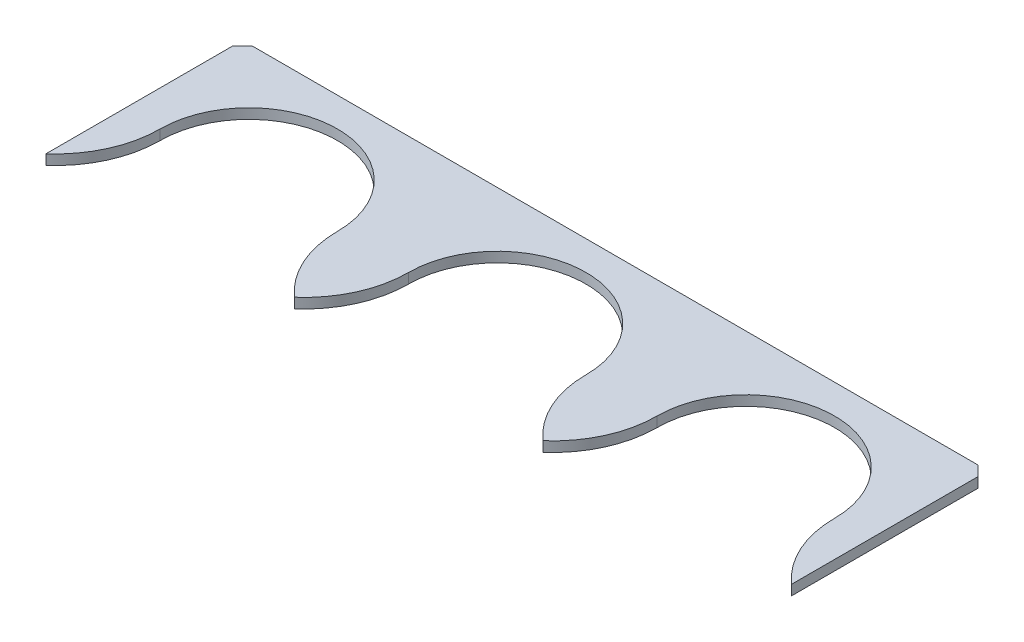
from build123d import *

# Parameters (mm, degrees)
BOSS_EXTRUDE1_DEPTH = 6.35


with BuildPart() as part:
    # Sketch1 → Boss-Extrude1 (new body)
    with BuildSketch(Plane(origin=(0, 0, 0), x_dir=(1, 0, 0), z_dir=(0, 1, 0))):
        with BuildLine():
            ThreePointArc((13.694028754, -34.373994235), (19.562343483, -61.559675463), (36.122228754, -83.903994235))
            Line((36.122228754, -83.903994235), (36.122228754, 39.921005765))
            Line((36.122228754, 39.921005765), (-114.144171246, 39.921005765))
            Line((-114.144171246, 39.921005765), (-120.494171246, 33.571005765))
            Line((-120.494171246, 33.571005765), (-120.494171246, -83.903994235))
            ThreePointArc((-120.494171246, -83.903994235), (-103.934285976, -61.559675463), (-98.065971246, -34.373994235))
            ThreePointArc((-98.065971246, -34.373994235), (-42.185971246, 21.506005765), (13.694028754, -34.373994235))
        make_face()
        with BuildLine():
            Line((36.122228754, 39.921005765), (36.122228754, -83.903994235))
            ThreePointArc((36.122228754, -83.903994235), (52.682114024, -61.559675463), (58.550428754, -34.373994235))
            ThreePointArc((58.550428754, -34.373994235), (114.430428754, 21.506005765), (170.310428754, -34.373994235))
            ThreePointArc((170.310428754, -34.373994235), (176.178743483, -61.559675463), (192.738628754, -83.903994235))
            Line((192.738628754, -83.903994235), (192.738628754, 39.921005765))
            Line((192.738628754, 39.921005765), (36.122228754, 39.921005765))
        make_face()
        with BuildLine():
            Line((343.055828754, 39.921005765), (192.738628754, 39.921005765))
            Line((192.738628754, 39.921005765), (192.738628754, -83.903994235))
            ThreePointArc((192.738628754, -83.903994235), (209.316728258, -61.564916677), (215.192228754, -34.373994235))
            ThreePointArc((215.192228754, -34.373994235), (271.072228754, 21.506005765), (326.952228754, -34.373994235))
            ThreePointArc((326.952228754, -34.373994235), (332.827729249, -61.564916677), (349.405828754, -83.903994235))
            Line((349.405828754, -83.903994235), (349.405828754, 33.571005765))
            Line((349.405828754, 33.571005765), (343.055828754, 39.921005765))
        make_face()
    extrude(amount=-BOSS_EXTRUDE1_DEPTH)


solid = part.part
